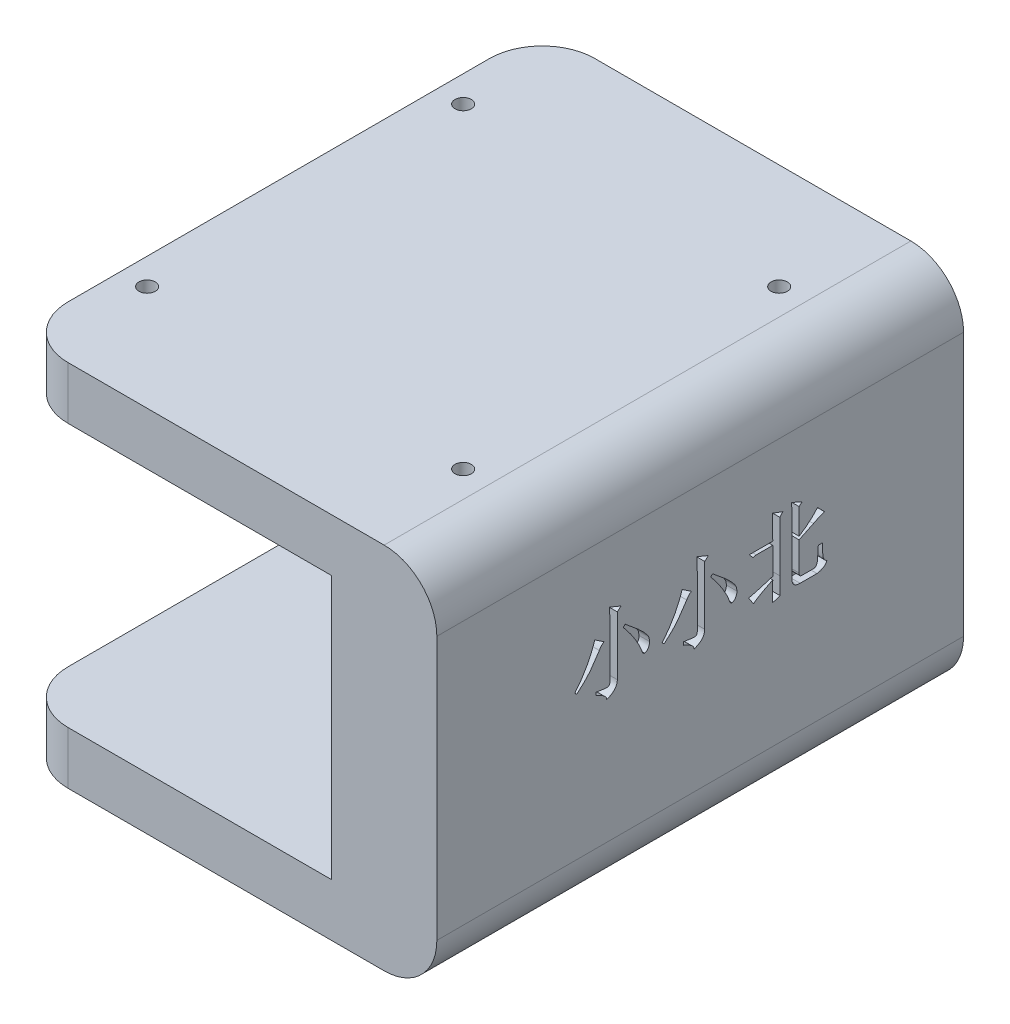
from build123d import *

# Parameters (mm, degrees)
EXTRUDE_1_DEPTH     = 100
SKETCH_2_R          = 1.55
CUT_EXTRUDE_1_DEPTH = 10
CUT_EXTRUDE_2_REACH = 142.712
SKETCH_6_W          = 100
SKETCH_6_H          = 70
EXTRUDE_2_DEPTH     = 10
FILLET_3_R          = 10
CUT_EXTRUDE_5_DEPTH = 2


with BuildPart() as part:
    # 草图1 → 凸台-拉伸1 (new body)
    with BuildSketch(Plane.XY):
        Polygon((0, 0), (0, 10), (70, 10), (70, -60), (0, -60), (0, -50), (60, -50), (60, 0), align=None)
    extrude(amount=EXTRUDE_1_DEPTH)

    # 草图2 → 切除-拉伸1 (cut)
    with BuildSketch(Plane(origin=(0, 10, 0), x_dir=(1, 0, 0), z_dir=(0, 1, 0))):
        with Locations(Location((5, -20, 0), (0, 0, 180))):
            Circle(SKETCH_2_R)
        with Locations(Location((65, -20, 0), (0, 0, 180))):
            Circle(SKETCH_2_R)
        with Locations(Location((65, -80, 0), (0, 0, 180))):
            Circle(SKETCH_2_R)
        with Locations(Location((5, -80, 0), (0, 0, 180))):
            Circle(SKETCH_2_R)
    extrude(amount=-CUT_EXTRUDE_1_DEPTH, mode=Mode.SUBTRACT)

    # 草图3 → 切除-拉伸2 (cut, up to next)
    with BuildSketch(Plane.XZ.offset(60), mode=Mode.PRIVATE) as cut_extrude_2_sk1:
        Polygon((25, 55), (20.669872981, 52.5), (20.669872981, 47.5), (25, 45), (29.330127019, 47.5), (29.330127019, 52.5), align=None)
    cut_extrude_2_tool1 = extrude(cut_extrude_2_sk1.sketch, amount=-CUT_EXTRUDE_2_REACH, mode=Mode.PRIVATE) & part.part
    add(cut_extrude_2_tool1.solids().sort_by_distance((25, -60, 50))[0], mode=Mode.SUBTRACT)

    # 草图6 → 凸台-拉伸2 (add)
    with BuildSketch(Plane(origin=(70, 0, 0), x_dir=(0, 0, -1), z_dir=(1, 0, 0))):
        with Locations((-50, -25)):
            Rectangle(SKETCH_6_W, SKETCH_6_H)
    extrude(amount=EXTRUDE_2_DEPTH)

    # 圆角3
    fillet_3_edges = [part.edges().sort_by_distance(p)[0] for p in [
        (0, -55, 0),
        (0, -55, 100),
        (0, 5, 100),
        (80, -60, 50),
        (80, 10, 50),
        (0, 5, 0),
    ]]
    fillet(fillet_3_edges, radius=FILLET_3_R)

    # 草图7 → 切除-拉伸5 (cut)
    with BuildSketch(Plane(origin=(80, 0, 0), x_dir=(0, 0, -1), z_dir=(1, 0, 0))):
        with BuildLine():
            add(Edge.make_bspline(
                [(-67.131636857, -14.871787705), (-67.131174581, -14.711661704), (-67.130270601, -14.398535814), (-67.13671913, -13.939584801), (-67.14049202, -13.501207501), (-67.147478609, -13.082648803), (-67.158020421, -12.684762122), (-67.165628222, -12.307326391), (-67.181449296, -11.950713418), (-67.191134616, -11.719256728), (-67.195844825, -11.606693673)],
                knots=[0, 0, 0, 0, 1.176649029, 2.300933463, 3.372795891, 4.398143969, 5.377020503, 6.297664633, 7.172112632, 8, 8, 8, 8], degree=3))
            Line((-67.195844825, -11.606693673), (-65.036554671, -12.496092921))
            Line((-65.036554671, -12.496092921), (-65.730951945, -13.11914801))
            Line((-65.730951945, -13.11914801), (-65.730951945, -24.272309706))
            add(Edge.make_bspline(
                [(-65.730951945, -24.272309706), (-65.736466648, -24.395813938), (-65.747314242, -24.638750609), (-65.846304242, -24.989626705), (-66.008654639, -25.313196669), (-66.235137809, -25.611413316), (-66.527969827, -25.87900309), (-66.879574751, -26.12637395), (-67.296128054, -26.344432997), (-67.601910876, -26.461003654), (-67.761826164, -26.521966628)],
                knots=[0, 0, 0, 0, 0.910401769, 1.790788623, 2.667666392, 3.570207343, 4.539229646, 5.585020184, 6.737037649, 8, 8, 8, 8], degree=3))
            add(Edge.make_bspline(
                [(-67.761826164, -26.521966628), (-67.763886202, -26.45296687), (-67.768138712, -26.310531534), (-67.862590981, -26.099412545), (-68.02027916, -25.894323229), (-68.244308164, -25.690064739), (-68.532984326, -25.486650111), (-68.88850186, -25.283521106), (-69.30842744, -25.07718522), (-69.615849353, -24.952037761), (-69.778431947, -24.885852503)],
                knots=[0, 0, 0, 0, 0.601444259, 1.241553834, 1.988043463, 2.864998973, 3.893049285, 5.085004066, 6.458380546, 8, 8, 8, 8], degree=3))
            Line((-69.778431947, -24.885852503), (-69.778431947, -24.312736945))
            add(Edge.make_bspline(
                [(-69.778431947, -24.312736945), (-69.653259856, -24.333044146), (-69.414216783, -24.371825123), (-69.070448451, -24.419727211), (-68.760441367, -24.468016742), (-68.480761815, -24.498761381), (-68.233855186, -24.529496789), (-68.01801518, -24.548130555), (-67.834909638, -24.559564648), (-67.681584999, -24.568178694), (-67.550637034, -24.557146355), (-67.435525626, -24.526077254), (-67.340176866, -24.463253839), (-67.26207489, -24.380086167), (-67.201912082, -24.274178346), (-67.159350974, -24.145926237), (-67.137584761, -23.994006041), (-67.133707487, -23.885537124), (-67.131636857, -23.827610082)],
                knots=[0, 0, 0, 0, 1.924642554, 3.675519583, 5.268150949, 6.685890218, 7.945478767, 9.044577222, 9.972961638, 10.73133437, 11.371840587, 11.961879925, 12.519243118, 13.081004233, 13.679447898, 14.352895211, 15.120375572, 16, 16, 16, 16], degree=3))
            Line((-67.131636857, -23.827610082), (-67.131636857, -14.871787705))
        make_face()
        with BuildLine():
            Line((-70.023373451, -15.578075343), (-68.251709173, -16.77424599))
            add(Edge.make_bspline(
                [(-68.251709173, -16.77424599), (-68.340230503, -16.83010318), (-68.520017784, -16.943549422), (-68.755702359, -17.170859745), (-68.969415437, -17.439247639), (-69.087358881, -17.642141598), (-69.14824264, -17.746877788)],
                knots=[0, 0, 0, 0, 0.935569456, 1.900146426, 2.916031495, 4, 4, 4, 4], degree=3))
            add(Edge.make_bspline(
                [(-69.14824264, -17.746877788), (-69.189225988, -17.812030921), (-69.275631799, -17.949394253), (-69.41664026, -18.162464326), (-69.57078581, -18.396335033), (-69.742938445, -18.648591027), (-69.930382538, -18.921020307), (-70.132040027, -19.214414923), (-70.352526379, -19.52498876), (-70.582262462, -19.859376277), (-70.838915939, -20.204331058), (-71.124986285, -20.556175245), (-71.438776575, -20.914244514), (-71.780635031, -21.280630692), (-72.153844809, -21.65127699), (-72.552739474, -22.032720875), (-72.982487019, -22.417977396), (-73.280847086, -22.674014351), (-73.433529927, -22.805038754)],
                knots=[0, 0, 0, 0, 0.554492022, 1.169043894, 1.840597836, 2.572363608, 3.369116914, 4.222930652, 5.137080628, 6.112983699, 7.145474836, 8.233559663, 9.378897324, 10.574838797, 11.842783066, 13.167653779, 14.550574575, 16, 16, 16, 16], degree=3))
            Line((-73.433529927, -22.805038754), (-73.811643511, -22.462596262))
            add(Edge.make_bspline(
                [(-73.811643511, -22.462596262), (-73.6692199, -22.291643718), (-73.379428567, -21.943804159), (-72.962257029, -21.39281055), (-72.548035692, -20.810596407), (-72.145474892, -20.199646531), (-71.761054495, -19.575063603), (-71.409498153, -18.946009573), (-71.088480027, -18.324216277), (-70.812277988, -17.70888572), (-70.567469747, -17.119427223), (-70.35308825, -16.567685626), (-70.169945227, -16.060302323), (-70.070480303, -15.733058763), (-70.023373451, -15.578075343)],
                knots=[0, 0, 0, 0, 1.012200455, 2.059538572, 3.143276107, 4.262560843, 5.387658037, 6.479162642, 7.540459263, 8.570182648, 9.54669382, 10.444137775, 11.263139511, 12, 12, 12, 12], degree=3))
        make_face()
        with BuildLine():
            add(Edge.make_bspline(
                [(-64.239900264, -15.89198096), (-64.028752523, -16.060459932), (-63.622511883, -16.384607398), (-63.04322336, -16.856365365), (-62.519634226, -17.294457482), (-62.050531501, -17.695731914), (-61.636632287, -18.062799714), (-61.273869528, -18.391212159), (-60.969063899, -18.688453156), (-60.714991539, -18.954625691), (-60.500159211, -19.194061446), (-60.312784073, -19.412336584), (-60.15467734, -19.618409654), (-60.014829708, -19.803473248), (-59.905110657, -19.977323289), (-59.816183546, -20.132467561), (-59.751652809, -20.272891463), (-59.707357466, -20.434131764), (-59.677246805, -20.608487137), (-59.640348853, -20.786703989), (-59.623811121, -20.931625529), (-59.619006279, -21.015916115), (-59.616926631, -21.052399058)],
                knots=[0, 0, 0, 0, 2.281440375, 4.389409016, 6.309536451, 8.047255385, 9.602902067, 10.981879583, 12.179674078, 13.197766325, 14.089022652, 14.896532646, 15.626403216, 16.282540844, 16.854556202, 17.361119832, 17.792774331, 18.155105709, 18.769582436, 19.286958293, 19.69137882, 20, 20, 20, 20], degree=3))
            add(Edge.make_bspline(
                [(-59.616926631, -21.052399058), (-59.620382983, -21.147034937), (-59.627130396, -21.331781033), (-59.685561187, -21.598322761), (-59.781322411, -21.845214007), (-59.913018034, -22.062840641), (-60.059923207, -22.247831255), (-60.219449992, -22.381415863), (-60.381828613, -22.472730962), (-60.49660925, -22.483570481), (-60.551509264, -22.488755064)],
                knots=[0, 0, 0, 0, 1.219143167, 2.379984655, 3.499916424, 4.618354453, 5.649695874, 6.527881196, 7.295880001, 8, 8, 8, 8], degree=3))
            add(Edge.make_bspline(
                [(-60.551509264, -22.488755064), (-60.582150053, -22.486814509), (-60.643556525, -22.482925488), (-60.729020673, -22.439134358), (-60.812402579, -22.380183773), (-60.884704331, -22.289926321), (-60.957551287, -22.180653723), (-61.018886501, -22.043791139), (-61.079784079, -21.88539408), (-61.112149247, -21.770120577), (-61.129380968, -21.708747167)],
                knots=[0, 0, 0, 0, 0.704148253, 1.411166688, 2.186494152, 3.059302694, 4.06825091, 5.226989839, 6.523606146, 8, 8, 8, 8], degree=3))
            add(Edge.make_bspline(
                [(-61.129380968, -21.708747167), (-61.162632497, -21.619628368), (-61.230894499, -21.436676554), (-61.351942584, -21.162219811), (-61.481947496, -20.874865805), (-61.629865951, -20.58007021), (-61.789216721, -20.27316031), (-61.966776919, -19.958563375), (-62.152152688, -19.629530359), (-62.359407111, -19.294662834), (-62.576506735, -18.946103302), (-62.815978103, -18.590086323), (-63.06981018, -18.221808088), (-63.34066819, -17.842221126), (-63.634653445, -17.456000322), (-63.942880151, -17.056528486), (-64.269355889, -16.646532684), (-64.495540108, -16.372026181), (-64.61087963, -16.232045379)],
                knots=[0, 0, 0, 0, 0.70034653, 1.437740077, 2.208330686, 3.022864543, 3.866257083, 4.754748979, 5.683007186, 6.647137239, 7.654531947, 8.706927488, 9.806420313, 10.948525922, 12.140577183, 13.380632657, 14.664289768, 16, 16, 16, 16], degree=3))
            Line((-64.61087963, -16.232045379), (-64.239900264, -15.89198096))
        make_face()
        with BuildLine():
            add(Edge.make_bspline(
                [(-50.542200611, -14.871787705), (-50.541738335, -14.711661704), (-50.540834355, -14.398535814), (-50.547282884, -13.939584801), (-50.551055774, -13.501207501), (-50.558042363, -13.082648803), (-50.568584175, -12.684762122), (-50.576191976, -12.307326391), (-50.59201305, -11.950713418), (-50.60169837, -11.719256728), (-50.606408578, -11.606693673)],
                knots=[0, 0, 0, 0, 1.176649029, 2.300933463, 3.372795891, 4.398143969, 5.377020503, 6.297664633, 7.172112632, 8, 8, 8, 8], degree=3))
            Line((-50.606408578, -11.606693673), (-48.447118425, -12.496092921))
            Line((-48.447118425, -12.496092921), (-49.141515699, -13.11914801))
            Line((-49.141515699, -13.11914801), (-49.141515699, -24.272309706))
            add(Edge.make_bspline(
                [(-49.141515699, -24.272309706), (-49.147030402, -24.395813938), (-49.157877996, -24.638750609), (-49.256867996, -24.989626705), (-49.419218392, -25.313196669), (-49.645701563, -25.611413316), (-49.938533581, -25.87900309), (-50.290138505, -26.12637395), (-50.706691808, -26.344432997), (-51.01247463, -26.461003654), (-51.172389918, -26.521966628)],
                knots=[0, 0, 0, 0, 0.910401769, 1.790788623, 2.667666392, 3.570207343, 4.539229646, 5.585020184, 6.737037649, 8, 8, 8, 8], degree=3))
            add(Edge.make_bspline(
                [(-51.172389918, -26.521966628), (-51.174449956, -26.45296687), (-51.178702466, -26.310531534), (-51.273154735, -26.099412545), (-51.430842914, -25.894323229), (-51.654871918, -25.690064739), (-51.94354808, -25.486650111), (-52.299065614, -25.283521106), (-52.718991194, -25.07718522), (-53.026413106, -24.952037761), (-53.1889957, -24.885852503)],
                knots=[0, 0, 0, 0, 0.601444259, 1.241553834, 1.988043463, 2.864998973, 3.893049285, 5.085004066, 6.458380546, 8, 8, 8, 8], degree=3))
            Line((-53.1889957, -24.885852503), (-53.1889957, -24.312736945))
            add(Edge.make_bspline(
                [(-53.1889957, -24.312736945), (-53.06382361, -24.333044146), (-52.824780537, -24.371825123), (-52.481012205, -24.419727211), (-52.171005121, -24.468016742), (-51.891325569, -24.498761381), (-51.644418939, -24.529496789), (-51.428578934, -24.548130555), (-51.245473392, -24.559564648), (-51.092148753, -24.568178694), (-50.961200788, -24.557146355), (-50.84608938, -24.526077254), (-50.75074062, -24.463253839), (-50.672638644, -24.380086167), (-50.612475836, -24.274178346), (-50.569914727, -24.145926237), (-50.548148514, -23.994006041), (-50.544271241, -23.885537124), (-50.542200611, -23.827610082)],
                knots=[0, 0, 0, 0, 1.924642554, 3.675519583, 5.268150949, 6.685890218, 7.945478767, 9.044577222, 9.972961638, 10.73133437, 11.371840587, 11.961879925, 12.519243118, 13.081004233, 13.679447898, 14.352895211, 15.120375572, 16, 16, 16, 16], degree=3))
            Line((-50.542200611, -23.827610082), (-50.542200611, -14.871787705))
        make_face()
        with BuildLine():
            Line((-53.433937205, -15.578075343), (-51.662272927, -16.77424599))
            add(Edge.make_bspline(
                [(-51.662272927, -16.77424599), (-51.750794257, -16.83010318), (-51.930581538, -16.943549422), (-52.166266113, -17.170859745), (-52.379979191, -17.439247639), (-52.497922635, -17.642141598), (-52.558806393, -17.746877788)],
                knots=[0, 0, 0, 0, 0.935569456, 1.900146426, 2.916031495, 4, 4, 4, 4], degree=3))
            add(Edge.make_bspline(
                [(-52.558806393, -17.746877788), (-52.599789742, -17.812030921), (-52.686195553, -17.949394253), (-52.827204014, -18.162464326), (-52.981349563, -18.396335033), (-53.153502199, -18.648591027), (-53.340946292, -18.921020307), (-53.54260378, -19.214414923), (-53.763090132, -19.52498876), (-53.992826216, -19.859376277), (-54.249479692, -20.204331058), (-54.535550039, -20.556175245), (-54.849340329, -20.914244514), (-55.191198785, -21.280630692), (-55.564408563, -21.65127699), (-55.963303228, -22.032720875), (-56.393050773, -22.417977396), (-56.69141084, -22.674014351), (-56.844093681, -22.805038754)],
                knots=[0, 0, 0, 0, 0.554492022, 1.169043894, 1.840597836, 2.572363608, 3.369116914, 4.222930652, 5.137080628, 6.112983699, 7.145474836, 8.233559663, 9.378897324, 10.574838797, 11.842783066, 13.167653779, 14.550574575, 16, 16, 16, 16], degree=3))
            Line((-56.844093681, -22.805038754), (-57.222207265, -22.462596262))
            add(Edge.make_bspline(
                [(-57.222207265, -22.462596262), (-57.079783654, -22.291643718), (-56.789992321, -21.943804159), (-56.372820783, -21.39281055), (-55.958599446, -20.810596407), (-55.556038646, -20.199646531), (-55.171618248, -19.575063603), (-54.820061907, -18.946009573), (-54.499043781, -18.324216277), (-54.222841742, -17.70888572), (-53.978033501, -17.119427223), (-53.763652004, -16.567685626), (-53.580508981, -16.060302323), (-53.481044057, -15.733058763), (-53.433937205, -15.578075343)],
                knots=[0, 0, 0, 0, 1.012200455, 2.059538572, 3.143276107, 4.262560843, 5.387658037, 6.479162642, 7.540459263, 8.570182648, 9.54669382, 10.444137775, 11.263139511, 12, 12, 12, 12], degree=3))
        make_face()
        with BuildLine():
            add(Edge.make_bspline(
                [(-47.650464018, -15.89198096), (-47.439316277, -16.060459932), (-47.033075637, -16.384607398), (-46.453787114, -16.856365365), (-45.93019798, -17.294457482), (-45.461095255, -17.695731914), (-45.047196041, -18.062799714), (-44.684433282, -18.391212159), (-44.379627653, -18.688453156), (-44.125555293, -18.954625691), (-43.910722964, -19.194061446), (-43.723347826, -19.412336584), (-43.565241094, -19.618409654), (-43.425393462, -19.803473248), (-43.315674411, -19.977323289), (-43.2267473, -20.132467561), (-43.162216563, -20.272891463), (-43.11792122, -20.434131764), (-43.087810559, -20.608487137), (-43.050912607, -20.786703989), (-43.034374875, -20.931625529), (-43.029570033, -21.015916115), (-43.027490385, -21.052399058)],
                knots=[0, 0, 0, 0, 2.281440375, 4.389409016, 6.309536451, 8.047255385, 9.602902067, 10.981879583, 12.179674078, 13.197766325, 14.089022652, 14.896532646, 15.626403216, 16.282540844, 16.854556202, 17.361119832, 17.792774331, 18.155105709, 18.769582436, 19.286958293, 19.69137882, 20, 20, 20, 20], degree=3))
            add(Edge.make_bspline(
                [(-43.027490385, -21.052399058), (-43.030946736, -21.147034937), (-43.03769415, -21.331781033), (-43.096124941, -21.598322761), (-43.191886165, -21.845214007), (-43.323581788, -22.062840641), (-43.470486961, -22.247831255), (-43.630013745, -22.381415863), (-43.792392367, -22.472730962), (-43.907173004, -22.483570481), (-43.962073018, -22.488755064)],
                knots=[0, 0, 0, 0, 1.219143167, 2.379984655, 3.499916424, 4.618354453, 5.649695874, 6.527881196, 7.295880001, 8, 8, 8, 8], degree=3))
            add(Edge.make_bspline(
                [(-43.962073018, -22.488755064), (-43.992713806, -22.486814509), (-44.054120279, -22.482925488), (-44.139584426, -22.439134358), (-44.222966333, -22.380183773), (-44.295268084, -22.289926321), (-44.368115041, -22.180653723), (-44.429450255, -22.043791139), (-44.490347833, -21.88539408), (-44.522713001, -21.770120577), (-44.539944722, -21.708747167)],
                knots=[0, 0, 0, 0, 0.704148253, 1.411166688, 2.186494152, 3.059302694, 4.06825091, 5.226989839, 6.523606146, 8, 8, 8, 8], degree=3))
            add(Edge.make_bspline(
                [(-44.539944722, -21.708747167), (-44.573196251, -21.619628368), (-44.641458253, -21.436676554), (-44.762506337, -21.162219811), (-44.89251125, -20.874865805), (-45.040429705, -20.58007021), (-45.199780475, -20.27316031), (-45.377340673, -19.958563375), (-45.562716441, -19.629530359), (-45.769970865, -19.294662834), (-45.987070489, -18.946103302), (-46.226541857, -18.590086323), (-46.480373934, -18.221808088), (-46.751231944, -17.842221126), (-47.045217199, -17.456000322), (-47.353443905, -17.056528486), (-47.679919643, -16.646532684), (-47.906103862, -16.372026181), (-48.021443383, -16.232045379)],
                knots=[0, 0, 0, 0, 0.70034653, 1.437740077, 2.208330686, 3.022864543, 3.866257083, 4.754748979, 5.683007186, 6.647137239, 7.654531947, 8.706927488, 9.806420313, 10.948525922, 12.140577183, 13.380632657, 14.664289768, 16, 16, 16, 16], degree=3))
            Line((-48.021443383, -16.232045379), (-47.650464018, -15.89198096))
        make_face()
        with BuildLine():
            add(Edge.make_bspline(
                [(-36.22144587, -16.251069961), (-36.22096925, -16.000577997), (-36.220047675, -15.516235313), (-36.226463164, -14.813921839), (-36.23024339, -14.159939144), (-36.237081187, -13.554307015), (-36.247711708, -12.99787114), (-36.255184117, -12.490457467), (-36.270730313, -12.032344443), (-36.280873648, -11.743034871), (-36.285653837, -11.606693673)],
                knots=[0, 0, 0, 0, 1.294219176, 2.502457882, 3.628786002, 4.673244003, 5.631761505, 6.504284573, 7.295123106, 8, 8, 8, 8], degree=3))
            Line((-36.285653837, -11.606693673), (-34.316609512, -12.358164695))
            Line((-34.316609512, -12.358164695), (-34.882590852, -12.983597857))
            Line((-34.882590852, -12.983597857), (-34.882590852, -22.602902561))
            add(Edge.make_bspline(
                [(-34.882590852, -22.602902561), (-34.881219893, -22.855771944), (-34.878396247, -23.376585392), (-34.869826163, -24.180437029), (-34.849941336, -25.028619562), (-34.832218926, -25.608797503), (-34.823139031, -25.906045758)],
                knots=[0, 0, 0, 0, 0.918478843, 1.891712341, 2.919840302, 4, 4, 4, 4], degree=3))
            Line((-34.823139031, -25.906045758), (-36.285653837, -26.369769965))
            add(Edge.make_bspline(
                [(-36.285653837, -26.369769965), (-36.281078772, -26.181105249), (-36.272139957, -25.812489941), (-36.256036361, -25.273538376), (-36.248304712, -24.761385396), (-36.237861426, -24.277878233), (-36.23048103, -23.82128391), (-36.226888965, -23.392416978), (-36.220233462, -22.990545232), (-36.221051784, -22.732113596), (-36.22144587, -22.607658706)],
                knots=[0, 0, 0, 0, 1.203710875, 2.351824244, 3.439052854, 4.47067558, 5.436491133, 6.351683416, 7.206207638, 8, 8, 8, 8], degree=3))
            add(Edge.make_bspline(
                [(-36.22144587, -22.607658706), (-36.443037054, -22.715396262), (-36.868049486, -22.922037158), (-37.471848966, -23.232575948), (-38.019614169, -23.520724696), (-38.507233233, -23.794919605), (-38.938402809, -24.048486253), (-39.311532366, -24.283307869), (-39.628659382, -24.497001893), (-39.811597645, -24.64453416), (-39.895568433, -24.712253184)],
                knots=[0, 0, 0, 0, 1.393980173, 2.673657386, 3.841297891, 4.895470426, 5.838457659, 6.670873179, 7.389915347, 8, 8, 8, 8], degree=3))
            Line((-39.895568433, -24.712253184), (-40.823016847, -23.283031398))
            add(Edge.make_bspline(
                [(-40.823016847, -23.283031398), (-40.783323601, -23.278687946), (-40.695685406, -23.269098098), (-40.553337198, -23.243467457), (-40.387974914, -23.214130147), (-40.201445286, -23.171672479), (-39.991798462, -23.124965789), (-39.759505062, -23.067833107), (-39.505453268, -23.000463786), (-39.229188173, -22.92743285), (-38.931294415, -22.843557598), (-38.61060263, -22.75038819), (-38.266551045, -22.650605488), (-37.899380035, -22.545149144), (-37.512598213, -22.4231926), (-37.100318613, -22.302612255), (-36.668596677, -22.165092518), (-36.372887847, -22.072467235), (-36.22144587, -22.025030857)],
                knots=[0, 0, 0, 0, 0.401300965, 0.886027105, 1.453384506, 2.089546235, 2.808687917, 3.61271276, 4.494090478, 5.450916611, 6.485333331, 7.605119619, 8.808099082, 10.08662132, 11.445280805, 12.884821941, 14.404617392, 16, 16, 16, 16], degree=3))
            Line((-36.22144587, -22.025030857), (-36.22144587, -16.933576871))
            Line((-36.22144587, -16.933576871), (-39.358123968, -16.933576871))
            Line((-39.358123968, -16.933576871), (-40.021606295, -17.059614733))
            Line((-40.021606295, -17.059614733), (-40.632771019, -16.251069961))
            Line((-40.632771019, -16.251069961), (-36.22144587, -16.251069961))
        make_face()
        with BuildLine():
            Line((-32.56634789, -24.343651892), (-32.56634789, -15.554294614))
            add(Edge.make_bspline(
                [(-32.56634789, -15.554294614), (-32.569454246, -14.915345569), (-32.575748706, -13.620632966), (-32.612129314, -12.326414779), (-32.630555857, -11.67090164)],
                knots=[0, 0, 0, 0, 0.987012939, 2, 2, 2, 2], degree=3))
            Line((-32.630555857, -11.67090164), (-30.661511532, -12.562678961))
            Line((-30.661511532, -12.562678961), (-31.227492872, -13.05256197))
            Line((-31.227492872, -13.05256197), (-31.227492872, -17.932367471))
            add(Edge.make_bspline(
                [(-31.227492872, -17.932367471), (-31.063449503, -17.828078264), (-30.736463262, -17.620199482), (-30.260405133, -17.288738576), (-29.798628911, -16.941445575), (-29.351284012, -16.577271437), (-28.918838472, -16.197403232), (-28.501800376, -15.800596958), (-28.09635949, -15.390491712), (-27.839171372, -15.103537248), (-27.710323117, -14.9597764)],
                knots=[0, 0, 0, 0, 1.009305725, 2.011840448, 3.011252227, 4.008975759, 5.006453026, 5.999307924, 6.997676551, 8, 8, 8, 8], degree=3))
            Line((-27.710323117, -14.9597764), (-26.376224245, -16.334302511))
            add(Edge.make_bspline(
                [(-26.376224245, -16.334302511), (-26.445341895, -16.351151991), (-26.589265305, -16.386237597), (-26.812630728, -16.45352855), (-27.051120583, -16.540596816), (-27.30923585, -16.639230022), (-27.581352091, -16.760084623), (-27.87333693, -16.892681228), (-28.180232784, -17.044918595), (-28.389831088, -17.15361494), (-28.497465233, -17.209433322)],
                knots=[0, 0, 0, 0, 0.742053848, 1.545175785, 2.431818882, 3.390032278, 4.42696815, 5.53699623, 6.735183921, 8, 8, 8, 8], degree=3))
            add(Edge.make_bspline(
                [(-28.497465233, -17.209433322), (-28.947448033, -17.433591626), (-29.851047176, -17.883718278), (-30.767449298, -18.307172807), (-31.227492872, -18.519751466)],
                knots=[0, 0, 0, 0, 0.995978811, 2, 2, 2, 2], degree=3))
            Line((-31.227492872, -18.519751466), (-31.227492872, -23.965538307))
            add(Edge.make_bspline(
                [(-31.227492872, -23.965538307), (-31.226966481, -24.01806914), (-31.225977569, -24.116756923), (-31.196829938, -24.253233734), (-31.163210271, -24.372711645), (-31.10289119, -24.467506191), (-31.030782325, -24.545963061), (-30.937543561, -24.596386451), (-30.831513475, -24.633415914), (-30.754635293, -24.635205146), (-30.713829135, -24.636154853)],
                knots=[0, 0, 0, 0, 1.305418677, 2.452443056, 3.470925331, 4.375734335, 5.22810969, 6.095693048, 6.989213206, 8, 8, 8, 8], degree=3))
            Line((-30.713829135, -24.636154853), (-28.44514763, -24.636154853))
            add(Edge.make_bspline(
                [(-28.44514763, -24.636154853), (-28.396436259, -24.632896223), (-28.301295821, -24.626531641), (-28.166200468, -24.578200473), (-28.051561541, -24.492391928), (-27.951468479, -24.378370009), (-27.874777345, -24.228076913), (-27.81035811, -24.049388491), (-27.76764999, -23.837771794), (-27.728140736, -23.509059224), (-27.699022218, -23.058622586), (-27.652530314, -22.485127737), (-27.616316081, -21.872150797), (-27.593602916, -21.450337652), (-27.581907183, -21.233132595)],
                knots=[0, 0, 0, 0, 0.465881786, 0.909935334, 1.350082177, 1.823320446, 2.349552859, 2.954376366, 3.637472089, 4.410142773, 6.122809611, 7.956517152, 9.917881569, 12, 12, 12, 12], degree=3))
            Line((-27.581907183, -21.233132595), (-26.825680015, -21.233132595))
            add(Edge.make_bspline(
                [(-26.825680015, -21.233132595), (-26.820788223, -21.398832066), (-26.811493589, -21.713668848), (-26.788175296, -22.160608013), (-26.76910523, -22.557202307), (-26.74239703, -22.903618002), (-26.71410778, -23.200120689), (-26.685850657, -23.447391653), (-26.64890974, -23.643675456), (-26.606137445, -23.839109965), (-26.516493525, -24.038589187), (-26.369220218, -24.245569599), (-26.170859238, -24.422011681), (-26.014980308, -24.512822771), (-25.933902693, -24.560056522)],
                knots=[0, 0, 0, 0, 1.646413474, 3.128262989, 4.444988973, 5.589877721, 6.578547478, 7.403728447, 8.060040423, 8.562259283, 9.387252433, 10.210967282, 11.069466888, 12, 12, 12, 12], degree=3))
            add(Edge.make_bspline(
                [(-25.933902693, -24.560056522), (-25.972589509, -24.639243148), (-26.049634852, -24.796944441), (-26.21067833, -25.007019363), (-26.400389683, -25.19524673), (-26.62453802, -25.35788595), (-26.881561947, -25.494735677), (-27.167899165, -25.611936532), (-27.48717074, -25.702322608), (-27.712258448, -25.740923899), (-27.82922676, -25.760983314)],
                knots=[0, 0, 0, 0, 0.899713269, 1.791791757, 2.69212616, 3.626444619, 4.613478119, 5.664660196, 6.786425278, 8, 8, 8, 8], degree=3))
            Line((-27.82922676, -25.760983314), (-31.027734752, -25.760983314))
            add(Edge.make_bspline(
                [(-31.027734752, -25.760983314), (-31.148565954, -25.757653459), (-31.375700586, -25.751394105), (-31.693335499, -25.68518634), (-31.963370434, -25.57356693), (-32.187835201, -25.416210069), (-32.36071488, -25.209943008), (-32.484115708, -24.96002088), (-32.554736177, -24.665324072), (-32.56232748, -24.45502686), (-32.56634789, -24.343651892)],
                knots=[0, 0, 0, 0, 1.208891478, 2.272435565, 3.22944578, 4.117302688, 4.990520541, 5.895917318, 6.885662158, 8, 8, 8, 8], degree=3))
        make_face()
    extrude(amount=-CUT_EXTRUDE_5_DEPTH, mode=Mode.SUBTRACT)


solid = part.part
